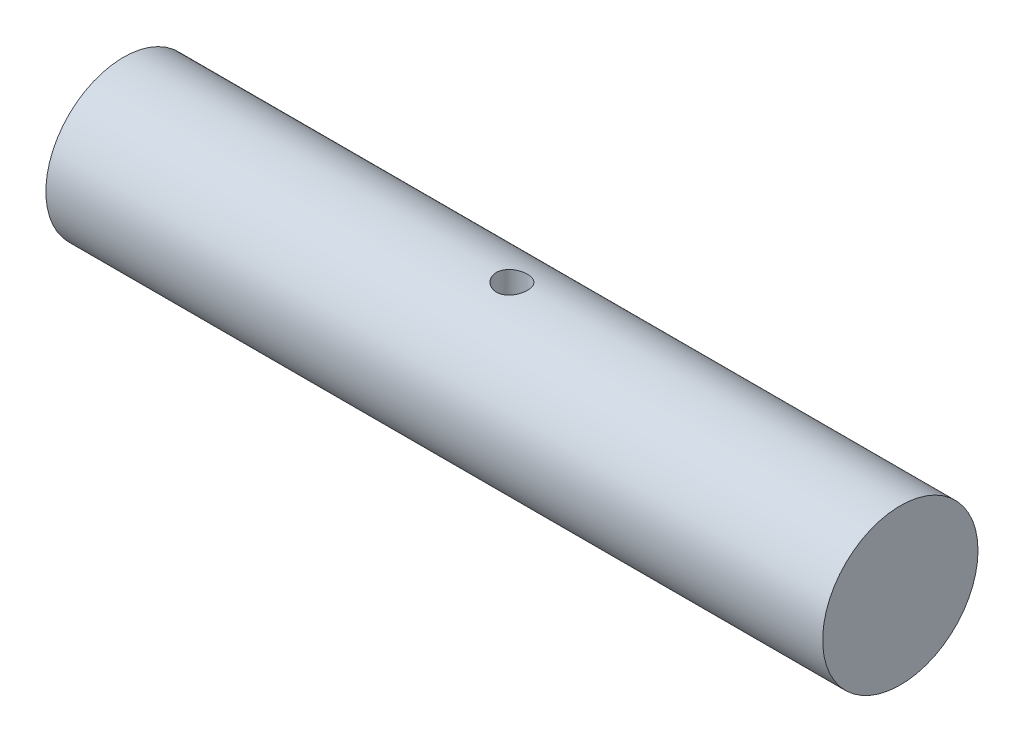
from build123d import *

# Parameters (mm, degrees)
SKETCH1_R               = 25
BOSS_EXTRUDE1_DEPTH     = 125
CUT_EXTRUDE1_DEPTH      = 130.903810568
CUT_EXTRUDE1_DEPTH_BACK = 130.903810568
SKETCH2_R               = 5


with BuildPart() as part:
    # Sketch1 → Boss-Extrude1 (new, symmetric)
    with BuildSketch(Plane(origin=(0, 0, 0), x_dir=(0, 0, -1), z_dir=(1, 0, 0))):
        Circle(SKETCH1_R)
    extrude(amount=BOSS_EXTRUDE1_DEPTH, both=True)

    # Sketch2 → Cut-Extrude1 (cut, two sides: drawn at the far end of the back side and taken through both)
    with BuildSketch(Plane(origin=(0, 0, 0), x_dir=(1, 0, 0), z_dir=(0, 1, 0)).offset(-CUT_EXTRUDE1_DEPTH_BACK)):
        with Locations(Location((0, 0, 0), (0, 0, 270))):
            Circle(SKETCH2_R)
    extrude(amount=CUT_EXTRUDE1_DEPTH + CUT_EXTRUDE1_DEPTH_BACK, mode=Mode.SUBTRACT)


solid = part.part
